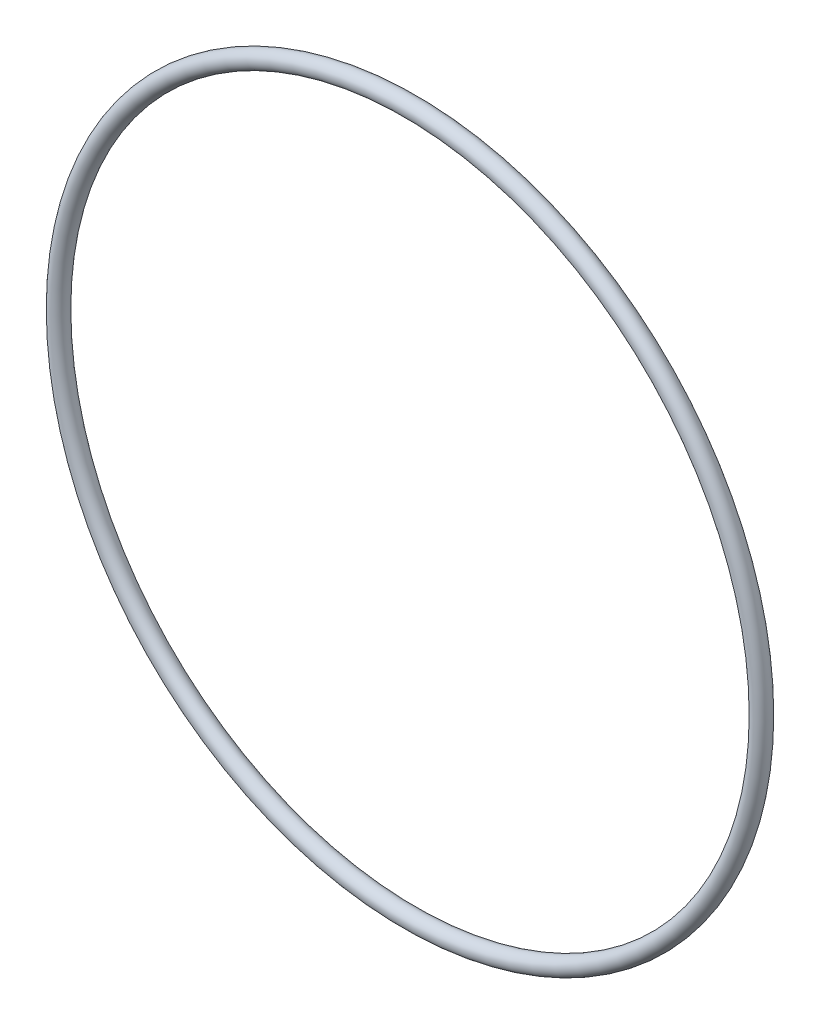
from build123d import *

# Parameters (mm, degrees)
SKETCH1_R = 1.7653


with BuildPart() as part:
    # Sketch1 → Revolve1 (revolve)
    with BuildSketch(Plane(origin=(0, 0, 0), x_dir=(0, -1, 0), z_dir=(1, 0, 0)), mode=Mode.PRIVATE) as revolve1_sk:
        with Locations((71.4121, 0)):
            Circle(SKETCH1_R)
    revolve(revolve1_sk.sketch.rotate(Axis((0, 0, 1.7653), (0, 0, -1)), 270), axis=Axis((0, 0, 1.7653), (0, 0, -1)))


solid = part.part
